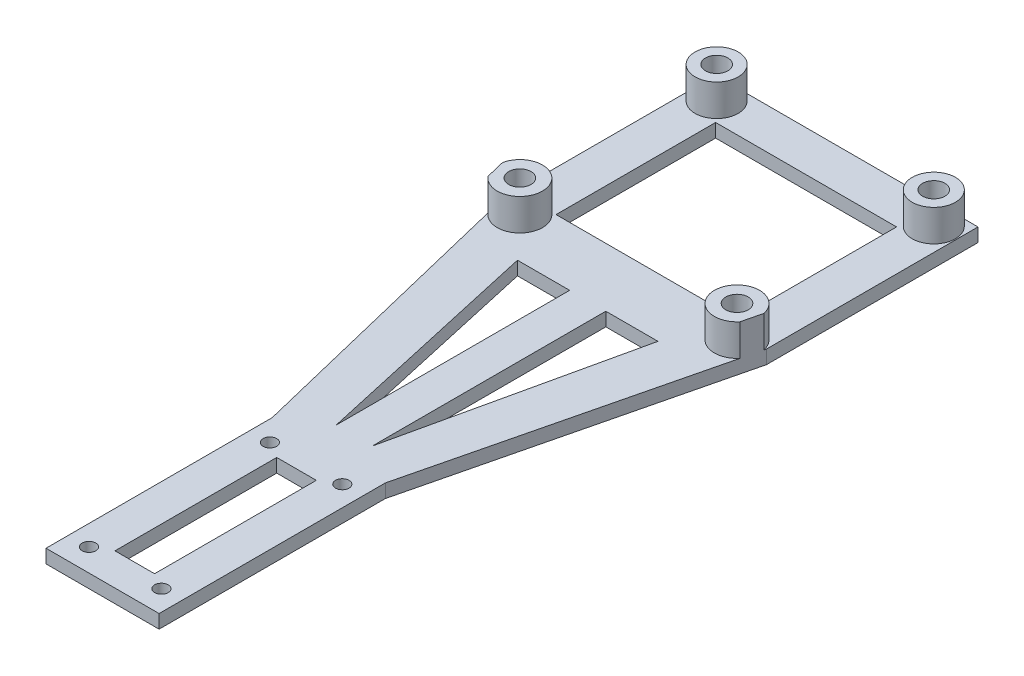
from build123d import *

# Parameters (mm, degrees)
SKETCH2_W           = 8.757359312
SKETCH2_H           = 35.757359312
SKETCH2_R           = 1.5
BOSS_EXTRUDE1_DEPTH = 3
SKETCH2_4_R         = 4.77269061
BOSS_EXTRUDE2_DEPTH = 6
SKETCH2_5_R         = 2.475
SKETCH2_5_R_2       = 4.77269061
BOSS_EXTRUDE3_DEPTH = 10


with BuildPart() as part:
    # Sketch2 → Boss-Extrude1 (new body)
    with BuildSketch(Plane(origin=(0, 0, 0), x_dir=(1, 0, 0), z_dir=(0, 1, 0))):
        Polygon((25, -50), (25, 0), (41.5, 67.785623806), (41.5, 114.52269061), (-16.5, 114.52269061), (-16.5, 67.785623806), (0, 0), (0, -50), align=None)
        with Locations((12.5, -25)):
            Rectangle(SKETCH2_W, SKETCH2_H, mode=Mode.SUBTRACT)
        with Locations((4.5, -45)):
            Circle(SKETCH2_R, mode=Mode.SUBTRACT)
        with Locations((20.5, -45)):
            Circle(SKETCH2_R, mode=Mode.SUBTRACT)
        with Locations((20.5, -5)):
            Circle(SKETCH2_R, mode=Mode.SUBTRACT)
        with Locations((4.5, -5)):
            Circle(SKETCH2_R, mode=Mode.SUBTRACT)
        Polygon((8.5, 57.25), (8.5, 5.628094968), (-3.028914458, 57.25), align=None, mode=Mode.SUBTRACT)
        Polygon((16.5, 57.25), (28.028914458, 57.25), (16.5, 5.628094968), align=None, mode=Mode.SUBTRACT)
        Polygon((-7.5, 105.52269061), (32.5, 105.52269061), (32.5, 88), (32.5, 70.25), (-7.5, 70.25), (-7.5, 88), align=None, mode=Mode.SUBTRACT)
    extrude(amount=BOSS_EXTRUDE1_DEPTH)

    # Sketch2<4> → Boss-Extrude2 (add)
    with BuildSketch(Plane(origin=(0, 0, 0), x_dir=(1, 0, 0), z_dir=(0, 1, 0))):
        with BuildLine():
            Line((-16.385347151, 67.314604722), (-15.349520723, 63.059202262))
            ThreePointArc((-15.349520723, 63.059202262), (-6.641853057, 67.432543142), (-16.385347151, 67.314604722))
        make_face()
        with BuildLine():
            Line((40.349520723, 63.059202262), (41.385347151, 67.314604722))
            ThreePointArc((41.385347151, 67.314604722), (31.641853057, 67.432543142), (40.349520723, 63.059202262))
        make_face()
        with Locations((-11.5, 109.75)):
            Circle(SKETCH2_4_R)
        with Locations((36.5, 109.75)):
            Circle(SKETCH2_4_R)
    extrude(amount=BOSS_EXTRUDE2_DEPTH)

    # Sketch2<5> → Boss-Extrude3 (add)
    # profile 1 of 4: a face of its own
    with BuildSketch(Plane(origin=(0, 0, 0), x_dir=(1, 0, 0), z_dir=(0, 1, 0))):
        with BuildLine():
            Line((-16.385347151, 67.314604722), (-15.349520723, 63.059202262))
            ThreePointArc((-15.349520723, 63.059202262), (-6.641853057, 67.432543142), (-16.385347151, 67.314604722))
        make_face()
        with Locations((-11.5, 66.25)):
            Circle(SKETCH2_5_R, mode=Mode.SUBTRACT)
    # profile 2 of 4: a face of its own
    with BuildSketch(Plane(origin=(0, 0, 0), x_dir=(1, 0, 0), z_dir=(0, 1, 0))):
        with BuildLine():
            ThreePointArc((41.385347151, 67.314604722), (31.641853057, 67.432543142), (40.349520723, 63.059202262))
            Line((40.349520723, 63.059202262), (41.385347151, 67.314604722))
        make_face()
        with Locations((36.5, 66.25)):
            Circle(SKETCH2_5_R, mode=Mode.SUBTRACT)
    # profile 3 of 4: a face of its own
    with BuildSketch(Plane(origin=(0, 0, 0), x_dir=(1, 0, 0), z_dir=(0, 1, 0))):
        with Locations((-11.5, 109.75)):
            Circle(SKETCH2_5_R_2)
        with Locations((-11.5, 109.75)):
            Circle(SKETCH2_5_R, mode=Mode.SUBTRACT)
    # profile 4 of 4: a face of its own
    with BuildSketch(Plane(origin=(0, 0, 0), x_dir=(1, 0, 0), z_dir=(0, 1, 0))):
        with Locations((36.5, 109.75)):
            Circle(SKETCH2_5_R_2)
        with Locations((36.5, 109.75)):
            Circle(SKETCH2_5_R, mode=Mode.SUBTRACT)
    extrude(amount=BOSS_EXTRUDE3_DEPTH)


solid = part.part
